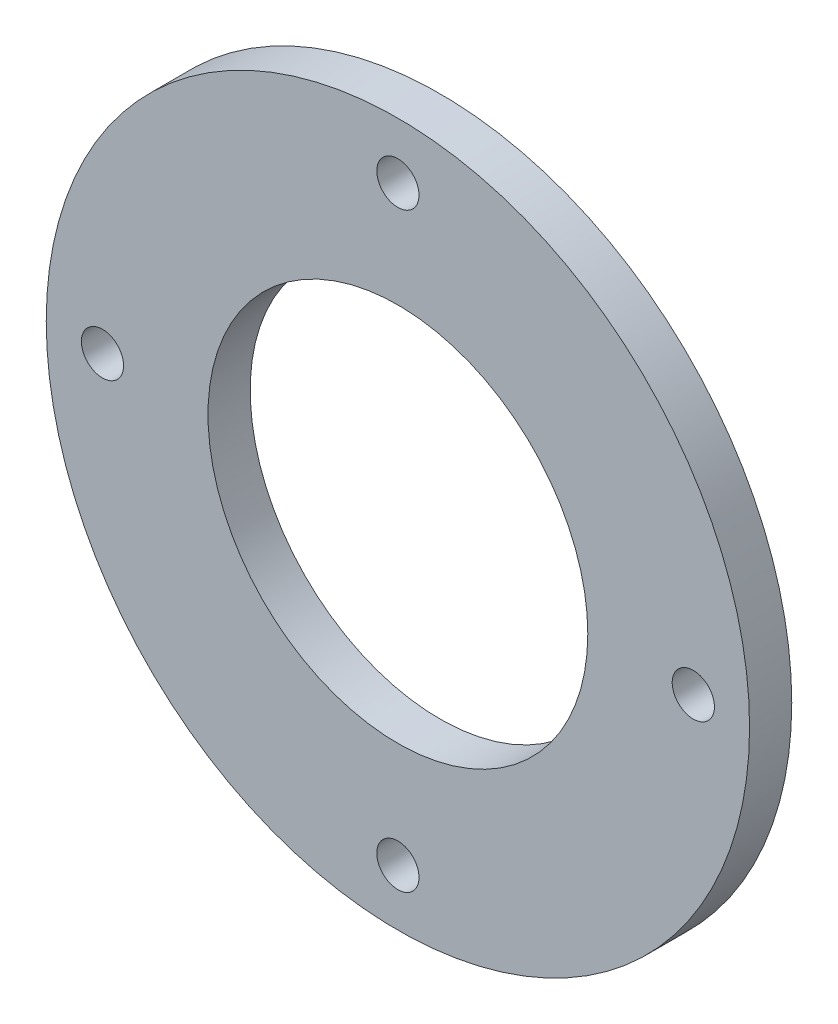
from build123d import *

# Parameters (mm, degrees)
SKETCH1_R           = 25
SKETCH1_R_2         = 13.5
SKETCH1_R_3         = 1.5
BOSS_EXTRUDE1_DEPTH = 3


with BuildPart() as part:
    # Sketch1 → Boss-Extrude1 (new body)
    with BuildSketch(Plane.XY):
        Circle(SKETCH1_R)
        Circle(SKETCH1_R_2, mode=Mode.SUBTRACT)
        with Locations((0, 21)):
            Circle(SKETCH1_R_3, mode=Mode.SUBTRACT)
        with Locations((21, 0)):
            Circle(SKETCH1_R_3, mode=Mode.SUBTRACT)
        with Locations((0, -21)):
            Circle(SKETCH1_R_3, mode=Mode.SUBTRACT)
        with Locations((-21, 0)):
            Circle(SKETCH1_R_3, mode=Mode.SUBTRACT)
    extrude(amount=BOSS_EXTRUDE1_DEPTH)


solid = part.part
